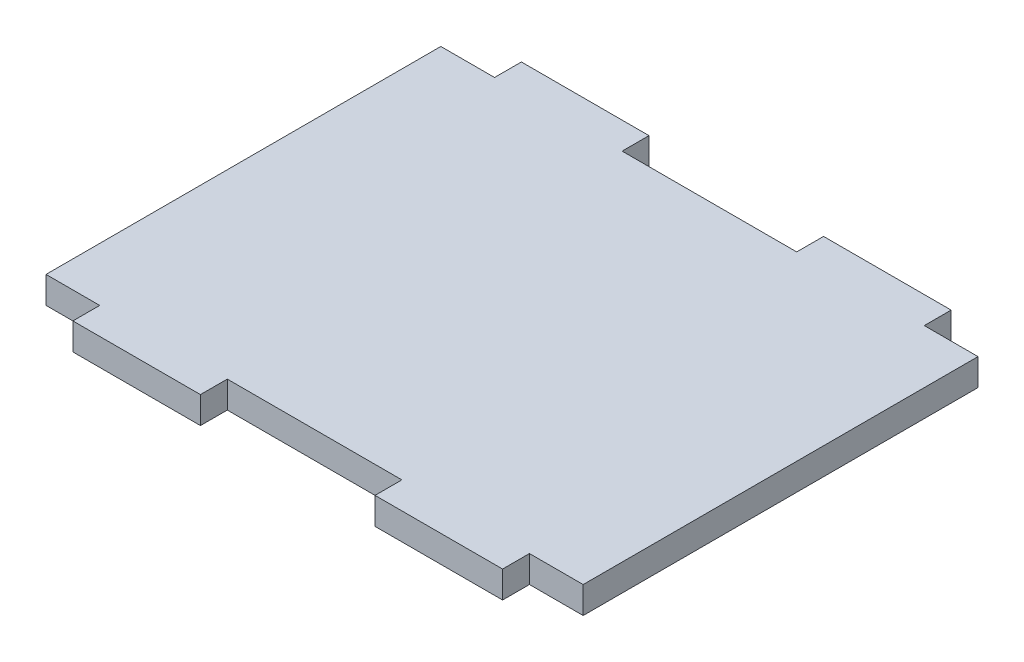
from build123d import *

# Parameters (mm, degrees)
SKETCH1_W           = 9.5
SKETCH1_H           = 2
BOSS_EXTRUDE1_DEPTH = 2


with BuildPart() as part:
    # Sketch1 → Boss-Extrude1 (new body)
    with BuildSketch(Plane(origin=(0, 0, 0), x_dir=(1, 0, 0), z_dir=(0, 1, 0))):
        Polygon((-6.5, 14.7), (-16, 14.7), (-20, 14.7), (-20, -14.7), (-16, -14.7), (-6.5, -14.7), (6.5, -14.7), (16, -14.7), (20, -14.7), (20, 14.7), (16, 14.7), (6.5, 14.7), align=None)
        with Locations((-11.25, 15.7)):
            Rectangle(SKETCH1_W, SKETCH1_H)
        with Locations((11.25, 15.7)):
            Rectangle(SKETCH1_W, SKETCH1_H)
        with Locations((-11.25, -15.7)):
            Rectangle(SKETCH1_W, SKETCH1_H)
        with Locations((11.25, -15.7)):
            Rectangle(SKETCH1_W, SKETCH1_H)
    extrude(amount=BOSS_EXTRUDE1_DEPTH)


solid = part.part
